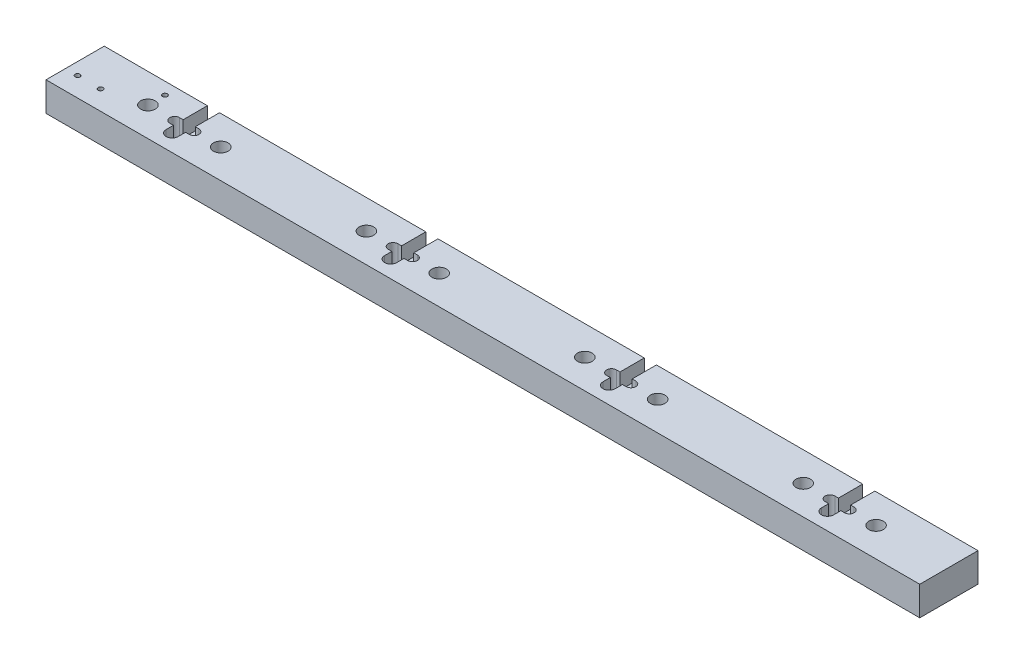
from build123d import *

# Parameters (mm, degrees)
SKETCH1_W                = 360
SKETCH1_H                = 24
BOSS_EXTRUDE1_DEPTH      = 12
CUT_EXTRUDE1_REACH       = 182.798
SKETCH2_R                = 3
CUT_EXTRUDE2_DEPTH       = 8
CUT_EXTRUDE3_DEPTH       = 6.5
LPATTERN1_COUNT          = 4
LPATTERN1_PITCH          = 90
F_2_0_2_DIAMETER_HOLE1_D = 2


with BuildPart() as part:
    # Sketch1 → Boss-Extrude1 (new body)
    with BuildSketch(Plane(origin=(0, 0, 0), x_dir=(1, 0, 0), z_dir=(0, 1, 0))):
        Rectangle(SKETCH1_W, SKETCH1_H)
    extrude(amount=BOSS_EXTRUDE1_DEPTH)

    # Sketch2 → Cut-Extrude1 (cut, up to next)
    with BuildSketch(Plane(origin=(0, 12, 0), x_dir=(1, 0, 0), z_dir=(0, 1, 0)), mode=Mode.PRIVATE) as cut_extrude1_sk1:
        with Locations(Location((-150, 0, 0), (0, 0, 270))):
            Circle(SKETCH2_R)
    cut_extrude1_tool1 = extrude(cut_extrude1_sk1.sketch, amount=-CUT_EXTRUDE1_REACH, mode=Mode.PRIVATE) & part.part
    # Sketch2 → Cut-Extrude1 (cut, up to next)
    with BuildSketch(Plane(origin=(0, 12, 0), x_dir=(1, 0, 0), z_dir=(0, 1, 0)), mode=Mode.PRIVATE) as cut_extrude1_sk2:
        with Locations(Location((-120, 0, 0), (0, 0, 270))):
            Circle(SKETCH2_R)
    cut_extrude1_tool2 = extrude(cut_extrude1_sk2.sketch, amount=-CUT_EXTRUDE1_REACH, mode=Mode.PRIVATE) & part.part
    cut_extrude1_1 = cut_extrude1_tool1.solids().sort_by_distance((-150, 12, 0))[0]
    add(cut_extrude1_1, mode=Mode.SUBTRACT)
    cut_extrude1_2 = cut_extrude1_tool2.solids().sort_by_distance((-120, 12, 0))[0]
    add(cut_extrude1_2, mode=Mode.SUBTRACT)
    cut_extrude1 = cut_extrude1_1 + cut_extrude1_2  # Cut-Extrude1 as one shape, for the pattern or mirror that repeats it

    # Sketch11 → Cut-Extrude2 (cut)
    with BuildSketch(Plane(origin=(-63.484819349, 12, 93.481372316), x_dir=(-1, 0, 0), z_dir=(0, 1, 0))):
        with BuildLine():
            Line((67.515180651, -91.481372316), (75.515180651, -91.481372316))
            ThreePointArc((75.515180651, -91.481372316), (77.515180651, -93.481372316), (75.515180651, -95.481372316))
            Line((75.515180651, -95.481372316), (67.515180651, -95.481372316))
            ThreePointArc((67.515180651, -95.481372316), (65.515180651, -93.481372316), (67.515180651, -91.481372316))
        make_face()
    cut_extrude2 = extrude(amount=-CUT_EXTRUDE2_DEPTH, mode=Mode.SUBTRACT)

    # Sketch13 → Cut-Extrude3 (cut)
    with BuildSketch(Plane(origin=(-63.484819349, 12, 93.481372316), x_dir=(-1, 0, 0), z_dir=(0, 1, 0))):
        with BuildLine():
            Line((74.015180651, -88.481372316), (74.015180651, -142.11123171))
            ThreePointArc((74.015180651, -142.11123171), (71.515180651, -144.61123171), (69.015180651, -142.11123171))
            Line((69.015180651, -142.11123171), (69.015180651, -88.481372316))
            ThreePointArc((69.015180651, -88.481372316), (71.515180651, -85.981372316), (74.015180651, -88.481372316))
        make_face()
    cut_extrude3 = extrude(amount=-CUT_EXTRUDE3_DEPTH, mode=Mode.SUBTRACT)

    # LPattern1: Cut-Extrude1, Cut-Extrude2, Cut-Extrude3 ×4
    with Locations(*[(i * LPATTERN1_PITCH, 0, 0) for i in range(1, LPATTERN1_COUNT)]):
        add(cut_extrude1, mode=Mode.SUBTRACT)
        add(cut_extrude2, mode=Mode.SUBTRACT)
        add(cut_extrude3, mode=Mode.SUBTRACT)

    # Ø2.0 (2) Diameter Hole1 (through all)
    with Locations(Plane.XZ):
        with Locations((-175, 4), (-165.5, 4), (-150, -7)):
            Hole(F_2_0_2_DIAMETER_HOLE1_D / 2)


solid = part.part
